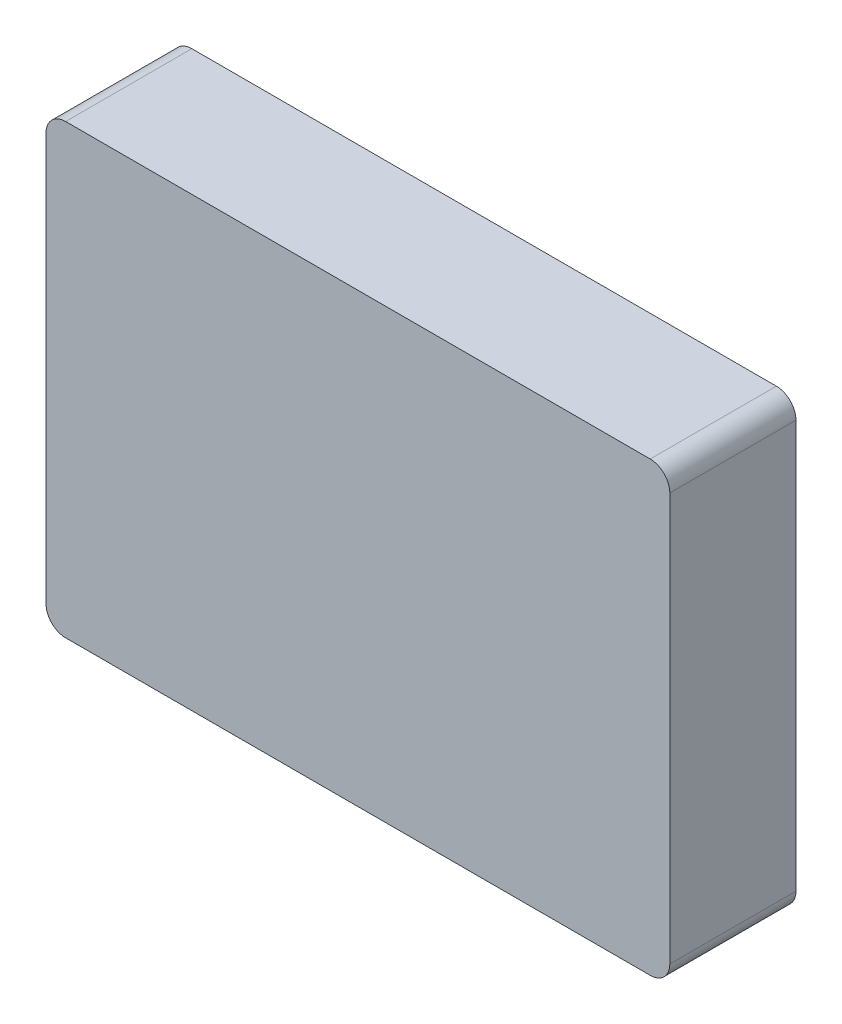
from build123d import *

# Parameters (mm, degrees)
BOSS_EXTRUDE1_DEPTH = 18


with BuildPart() as part:
    # Sketch1 → Boss-Extrude1 (new body)
    with BuildSketch(Plane.XY):
        with BuildLine():
            Line((-41.7, -31.9), (41.7, -31.9))
            ThreePointArc((41.7, -31.9), (43.679898987, -31.079898987), (44.5, -29.1))
            Line((44.5, -29.1), (44.5, 29.1))
            ThreePointArc((44.5, 29.1), (43.679898987, 31.079898987), (41.7, 31.9))
            Line((41.7, 31.9), (-41.7, 31.9))
            ThreePointArc((-41.7, 31.9), (-43.679898987, 31.079898987), (-44.5, 29.1))
            Line((-44.5, 29.1), (-44.5, -29.1))
            ThreePointArc((-44.5, -29.1), (-43.679898987, -31.079898987), (-41.7, -31.9))
        make_face()
    extrude(amount=BOSS_EXTRUDE1_DEPTH)


solid = part.part
